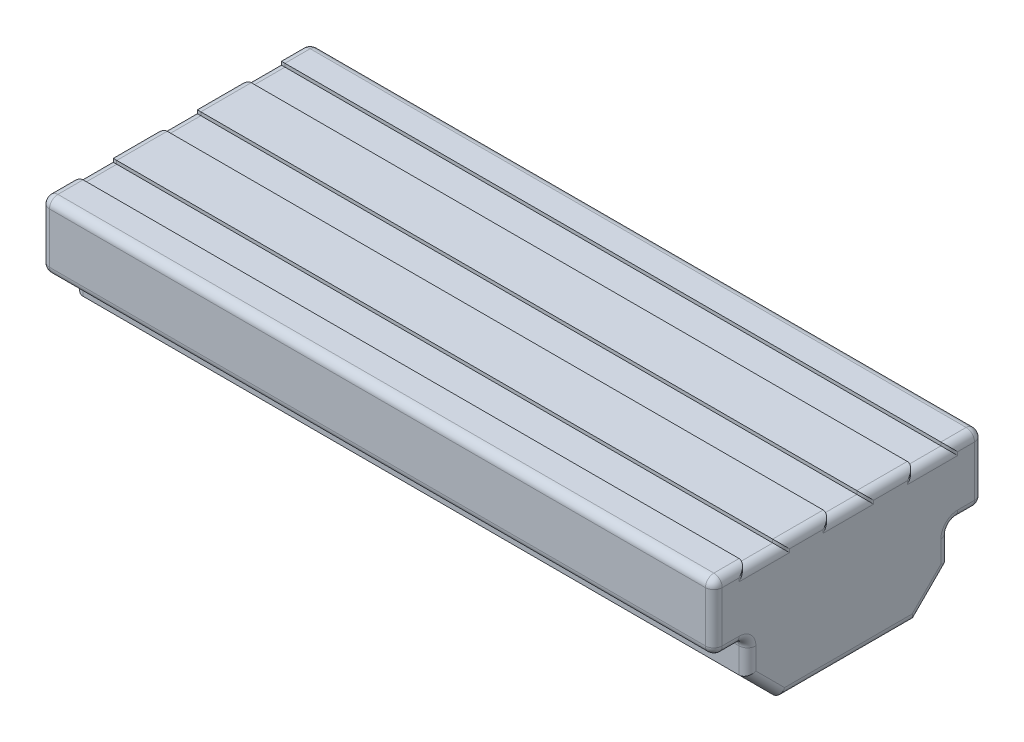
from build123d import *

# Parameters (mm, degrees)
ESQUISSE1_W             = 40
ESQUISSE1_H             = 8
BOSS_EXTRU_1_DEPTH      = 8
BOSS_EXTRU_3_DEPTH      = 40
ESQUISSE6_W             = 40
ESQUISSE6_H             = 4
BOSS_EXTRU_4_DEPTH      = 2
ESQUISSE7_R             = 2
ENL_V_MAT_EXTRU_1_DEPTH = 6
ESQUISSE10_W            = 40
ESQUISSE10_H            = 2
ENL_V_MAT_EXTRU_4_DEPTH = 0.2
CONG_2_R                = 0.5
CONG_3_R                = 0.5
CONG_4_R                = 0.5


with BuildPart() as part:
    # Esquisse1 → Boss.-Extru.1 (new body)
    with BuildSketch(Plane(origin=(0, 0, 0), x_dir=(1, 0, 0), z_dir=(0, 1, 0))):
        Rectangle(ESQUISSE1_W, ESQUISSE1_H)
    extrude(amount=BOSS_EXTRU_1_DEPTH)

    # Esquisse5 → Boss.-Extru.3 (add)
    with BuildSketch(Plane.ZY.offset(20)):
        Polygon((-4, 0), (-6, 2), (-6, 8), (-4, 8), align=None)
    boss_extru_3 = extrude(amount=-BOSS_EXTRU_3_DEPTH)

    # Symétrie2: Boss.-Extru.3 across plane
    add(boss_extru_3.mirror(Plane(origin=(0, 0, 0), x_dir=(1, 0, 0), z_dir=(0, 0, -1))))

    # Esquisse6 → Boss.-Extru.4 (add)
    with BuildSketch(Plane(origin=(0, 0, -6), x_dir=(-1, 0, 0), z_dir=(0, 0, -1))):
        with Locations((0, 6)):
            Rectangle(ESQUISSE6_W, ESQUISSE6_H)
    boss_extru_4 = extrude(amount=BOSS_EXTRU_4_DEPTH)

    # Symétrie4: Boss.-Extru.4 across plane
    add(boss_extru_4.mirror(Plane(origin=(0, 0, 0), x_dir=(1, 0, 0), z_dir=(0, 0, -1))))

    # Esquisse7 → Enlèv. mat.-Extru.1 (cut)
    with BuildSketch(Plane.XZ):
        with Locations(Location((-15, 0, 0), (0, 0, 270))):
            Circle(ESQUISSE7_R)
    enl_v_mat_extru_1 = extrude(amount=-ENL_V_MAT_EXTRU_1_DEPTH, mode=Mode.SUBTRACT)

    # Symétrie10: Enlèv. mat.-Extru.1 across plane
    add(enl_v_mat_extru_1.mirror(Plane(origin=(0, 0, 0), x_dir=(0, 0, 1), z_dir=(1, 0, 0))), mode=Mode.SUBTRACT)

    # Esquisse10 → Enlèv. mat.-Extru.4 (cut)
    with BuildSketch(Plane(origin=(0, 8, 0), x_dir=(1, 0, 0), z_dir=(0, 1, 0))):
        Rectangle(ESQUISSE10_W, ESQUISSE10_H)
        with Locations((0, 5)):
            Rectangle(ESQUISSE10_W, ESQUISSE10_H)
        with Locations((0, -5)):
            Rectangle(ESQUISSE10_W, ESQUISSE10_H)
    extrude(amount=-ENL_V_MAT_EXTRU_4_DEPTH, mode=Mode.SUBTRACT)

    # Congé2
    cong_2_edges = [part.edges().sort_by_distance(p)[0] for p in [
        (0, 8, -8),
        (0, 8, 8),
    ]]
    fillet(cong_2_edges, radius=CONG_2_R)

    # Congé3
    cong_3_edges = [part.edges().sort_by_distance(p)[0] for p in [
        (0, 4, -6),
        (0, 4, -8),
        (0, 4, 8),
        (0, 4, 6),
    ]]
    fillet(cong_3_edges, radius=CONG_3_R)

    # Congé4
    cong_4_edges = [part.edges().sort_by_distance(p)[0] for p in [
        (-20, 7.8, -5),
        (-20, 7.9, -4),
        (-20, 7.9, -6),
        (20, 7.8, -5),
        (20, 7.9, -6),
        (20, 7.9, -4),
        (-20, 7.8, 5),
        (-20, 7.9, 6),
        (-20, 7.9, 4),
        (20, 7.8, 5),
        (20, 7.9, 4),
        (20, 7.9, 6),
        (20, 8, 6.75),
        (20, 6, 8),
        (20, 6, -8),
        (20, 7.853553391, -7.853553391),
        (20, 7.853553391, 7.853553391),
        (-20, 8, -6.75),
        (-20, 7.853553391, -7.853553391),
        (-20, 7.853553391, 7.853553391),
        (20, 2.75, 6),
        (-20, 2.75, 6),
        (20, 4, 7),
        (-20, 4, 7),
        (20, 1, -5),
        (-20, 6, 8),
        (-20, 6, -8),
        (-20, 4, -7),
        (-20, 2.75, -6),
        (-20, 4.146446609, -7.853553391),
        (-20, 4.146446609, 7.853553391),
        (20, 2.75, -6),
        (20, 4, -7),
        (20, 4.146446609, -7.853553391),
        (20, 4.146446609, 7.853553391),
        (-20, 3.853553391, 6.146446609),
        (20, 3.853553391, 6.146446609),
        (-20, 3.853553391, -6.146446609),
        (20, 3.853553391, -6.146446609),
        (-20, 1, -5),
        (-20, 1, 5),
        (20, 1, 5),
        (-20, 0, 0),
        (20, 0, 0),
        (20, 8, -2.5),
        (-20, 8, 2.5),
        (-20, 7.8, 0),
        (-20, 7.9, 1),
        (-20, 7.9, -1),
        (20, 7.8, 0),
        (20, 7.9, -1),
        (20, 7.9, 1),
        (-20, 8, 6.75),
        (20, 8, 2.5),
        (-20, 8, -2.5),
        (20, 8, -6.75),
    ]]
    fillet(cong_4_edges, radius=CONG_4_R)


solid = part.part
